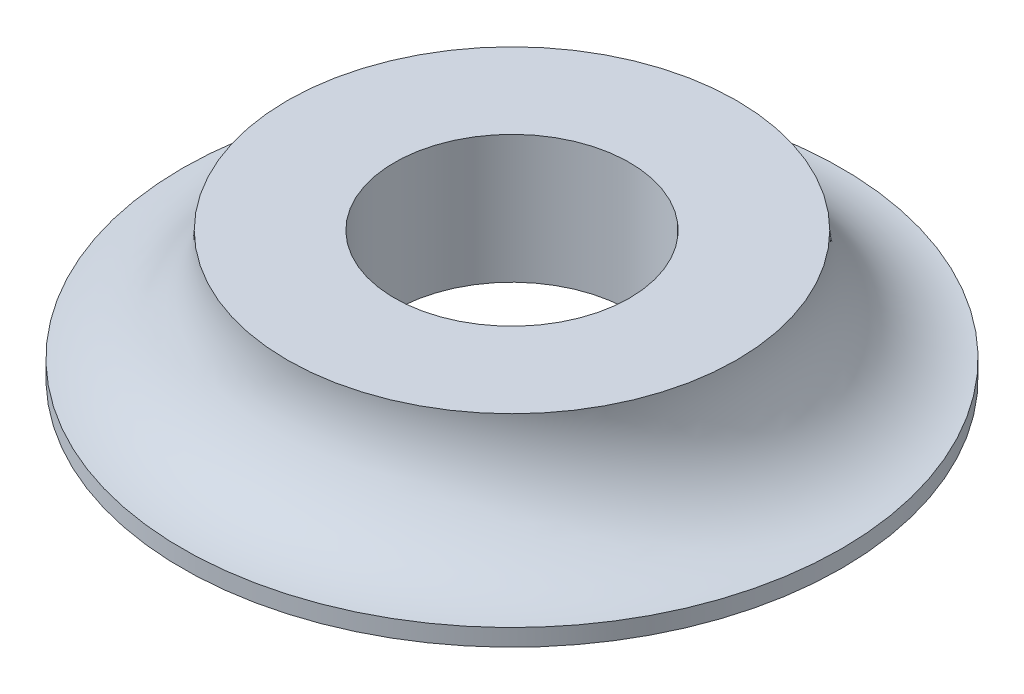
from build123d import *


with BuildPart() as part:
    # Sketch1 → Revolve1 (revolve)
    with BuildSketch(Plane.XY):
        with BuildLine():
            Line((3.9624, 4.318), (3.9624, 0))
            Line((3.9624, 0), (11.1125, 0))
            Line((11.1125, 0), (11.1125, 0.574855587))
            ThreePointArc((11.1125, 0.574855587), (8.569404287, 1.714154084), (7.576769755, 4.318))
            Line((7.576769755, 4.318), (3.9624, 4.318))
        make_face()
    revolve(axis=Axis((0, 0, 0), (0, 1, 0)))


solid = part.part
